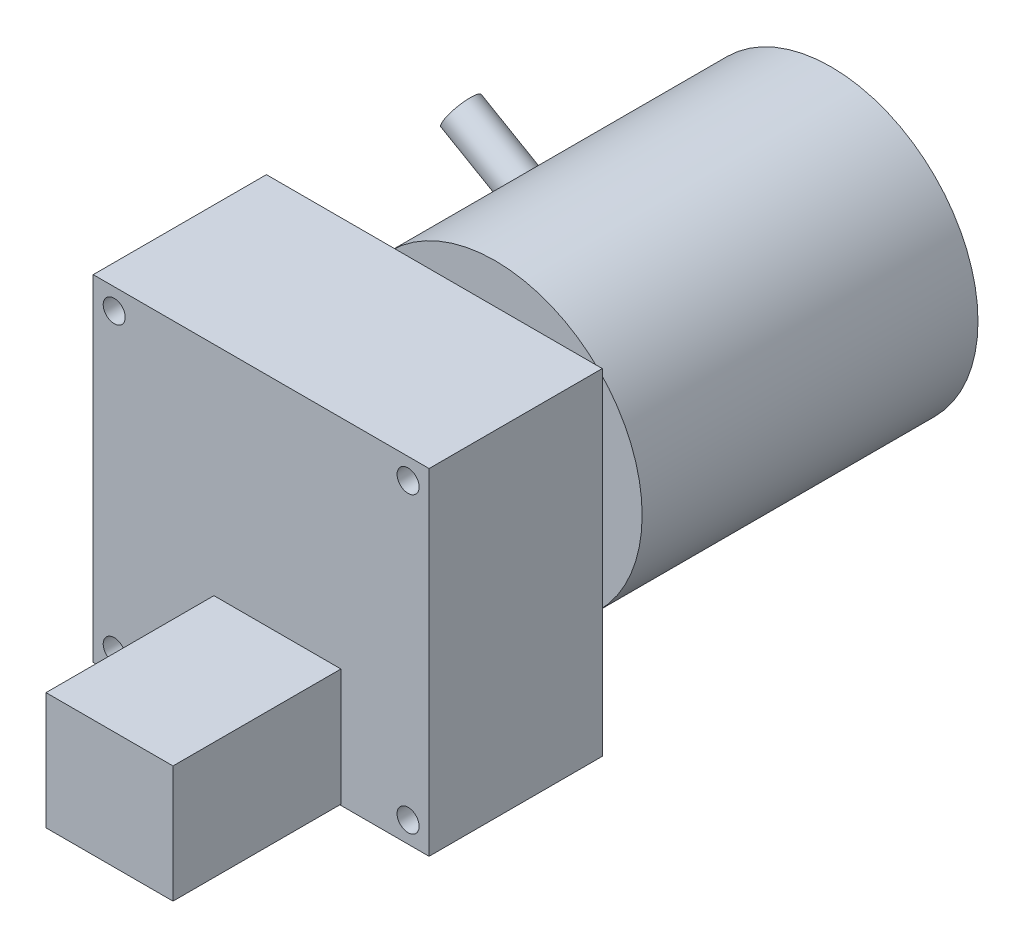
from build123d import *

# Parameters (mm, degrees)
SKETCH_1_R          = 14
EXTRUDE_1_DEPTH     = 32
SKETCH_2_W          = 12
SKETCH_2_H          = 11
EXTRUDE_2_DEPTH     = 5.8
SKETCH_3_W          = 32
SKETCH_3_H          = 32
EXTRUDE_3_DEPTH     = 16.5
SKETCH_4_W          = 12.1
SKETCH_4_H          = 11.16
EXTRUDE_4_DEPTH     = 16
SKETCH_5_R          = 1.05
CUT_EXTRUDE_1_DEPTH = 16.5
EXTRUDE_START       = -21.86
SKETCH_6_R          = 1.75
EXTRUDE_6_DEPTH     = 20.5


with BuildPart() as part:
    # 草图1 → 凸台-拉伸1 (new body)
    with BuildSketch(Plane.XY):
        Circle(SKETCH_1_R)
    extrude(amount=EXTRUDE_1_DEPTH)

    # 草图2 → 凸台-拉伸2 (add)
    with BuildSketch(Plane.XY.offset(32)):
        Rectangle(SKETCH_2_W, SKETCH_2_H)
    extrude(amount=EXTRUDE_2_DEPTH)

    # 草图3 → 凸台-拉伸3 (add)
    with BuildSketch(Plane.XY.offset(37.8)):
        Rectangle(SKETCH_3_W, SKETCH_3_H)
    extrude(amount=EXTRUDE_3_DEPTH)

    # 草图4 → 凸台-拉伸4 (add)
    with BuildSketch(Plane.XY.offset(54.3)):
        with Locations((1.55, -10.32)):
            Rectangle(SKETCH_4_W, SKETCH_4_H)
    extrude(amount=EXTRUDE_4_DEPTH)

    # 草图5 → 切除-拉伸1 (cut)
    with BuildSketch(Plane.XY.offset(54.3)):
        with Locations((-14, 14)):
            Circle(SKETCH_5_R)
        with Locations((14, 14)):
            Circle(SKETCH_5_R)
        with Locations((-14, -14)):
            Circle(SKETCH_5_R)
        with Locations((14, -14)):
            Circle(SKETCH_5_R)
    extrude(amount=-CUT_EXTRUDE_1_DEPTH, mode=Mode.SUBTRACT)

    # 草图6 → 凸台-拉伸6 (add)
    with BuildSketch(Plane(origin=(-18.92820323, 10.92820323, 0), x_dir=(0, 0, -1), z_dir=(-0.8660254037844398, 0.499999999999998, 0)).offset(EXTRUDE_START)):
        with Locations(Location((-17.5, 0, 0), (0, 0, 270))):
            Circle(SKETCH_6_R)
    extrude(amount=EXTRUDE_6_DEPTH)


solid = part.part
